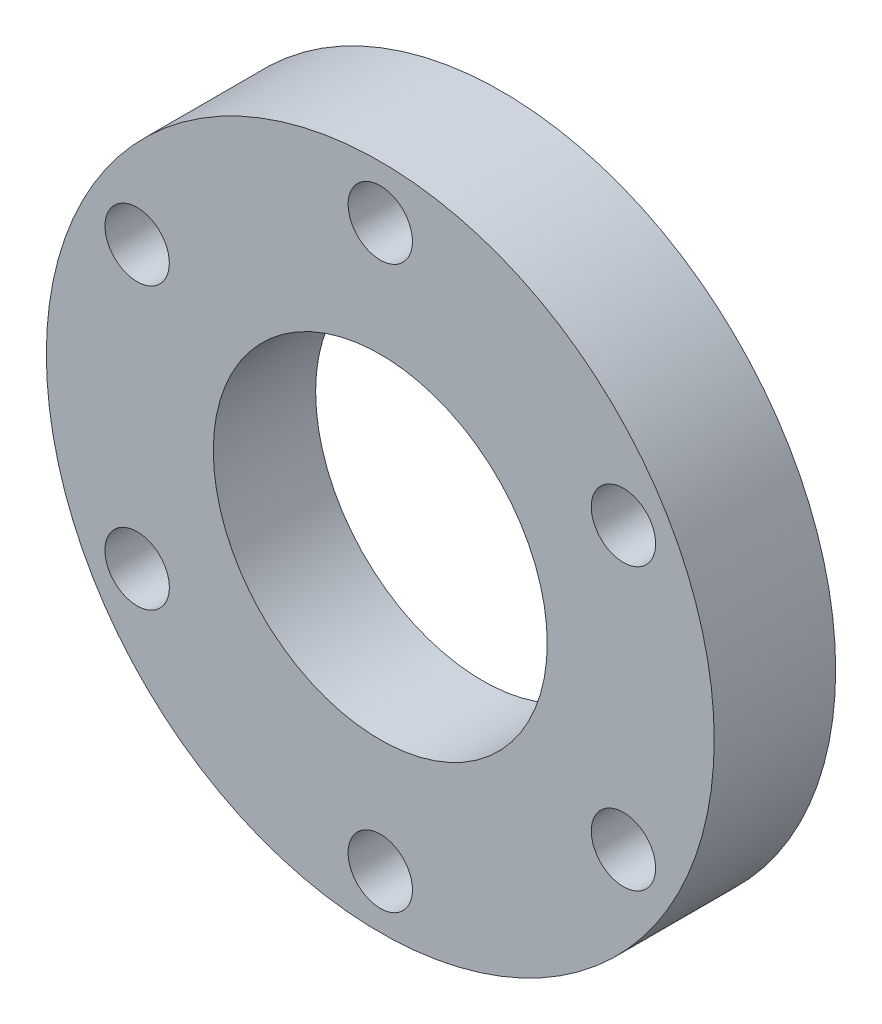
from build123d import *

# Parameters (mm, degrees)
SKETCH1_R          = 34.925
SKETCH1_R_2        = 8
BASE_EXTRUDE_DEPTH = 12.7
SKETCH6_R          = 3.3655
CUT_EXTRUDE1_DEPTH = 51.998051433
CIRPATTERN2_COUNT  = 6
SKETCH11_R         = 23.07124837
CUT_EXTRUDE3_DEPTH = 2
SKETCH12_R         = 11.5
CUT_EXTRUDE4_DEPTH = 2
SKETCH14_R         = 17.4625
CUT_EXTRUDE5_DEPTH = 51.998051433


with BuildPart() as part:
    # Sketch1 → Base-Extrude (new body)
    with BuildSketch(Plane.XY):
        Circle(SKETCH1_R)
        Circle(SKETCH1_R_2, mode=Mode.SUBTRACT)
    extrude(amount=BASE_EXTRUDE_DEPTH)

    # Sketch6 → Cut-Extrude1 (cut, through all)
    with BuildSketch(Plane(origin=(0, 0, 0), x_dir=(-1, 0, 0), z_dir=(0, 0, -1))):
        with Locations((0, 29.3624)):
            Circle(SKETCH6_R)
    cut_extrude1 = extrude(amount=-CUT_EXTRUDE1_DEPTH, mode=Mode.SUBTRACT)

    # CirPattern2: Cut-Extrude1 ×6 about axis
    cirpattern2_axis = Axis((0, 0, 0), (0, 0, 1))
    for i in range(1, CIRPATTERN2_COUNT):
        add(cut_extrude1.rotate(cirpattern2_axis, i * 360 / CIRPATTERN2_COUNT), mode=Mode.SUBTRACT)

    # Sketch11 → Cut-Extrude3 (cut)
    with BuildSketch(Plane(origin=(0, 0, 0), x_dir=(-1, 0, 0), z_dir=(0, 0, -1))):
        Circle(SKETCH11_R)
    extrude(amount=-CUT_EXTRUDE3_DEPTH, mode=Mode.SUBTRACT)

    # Sketch12 → Cut-Extrude4 (cut)
    with BuildSketch(Plane.XY.offset(12.7)):
        Circle(SKETCH12_R)
    extrude(amount=-CUT_EXTRUDE4_DEPTH, mode=Mode.SUBTRACT)

    # Sketch14 → Cut-Extrude5 (cut, through all)
    with BuildSketch(Plane.XY.offset(12.7)):
        Circle(SKETCH14_R)
    extrude(amount=-CUT_EXTRUDE5_DEPTH, mode=Mode.SUBTRACT)


solid = part.part
